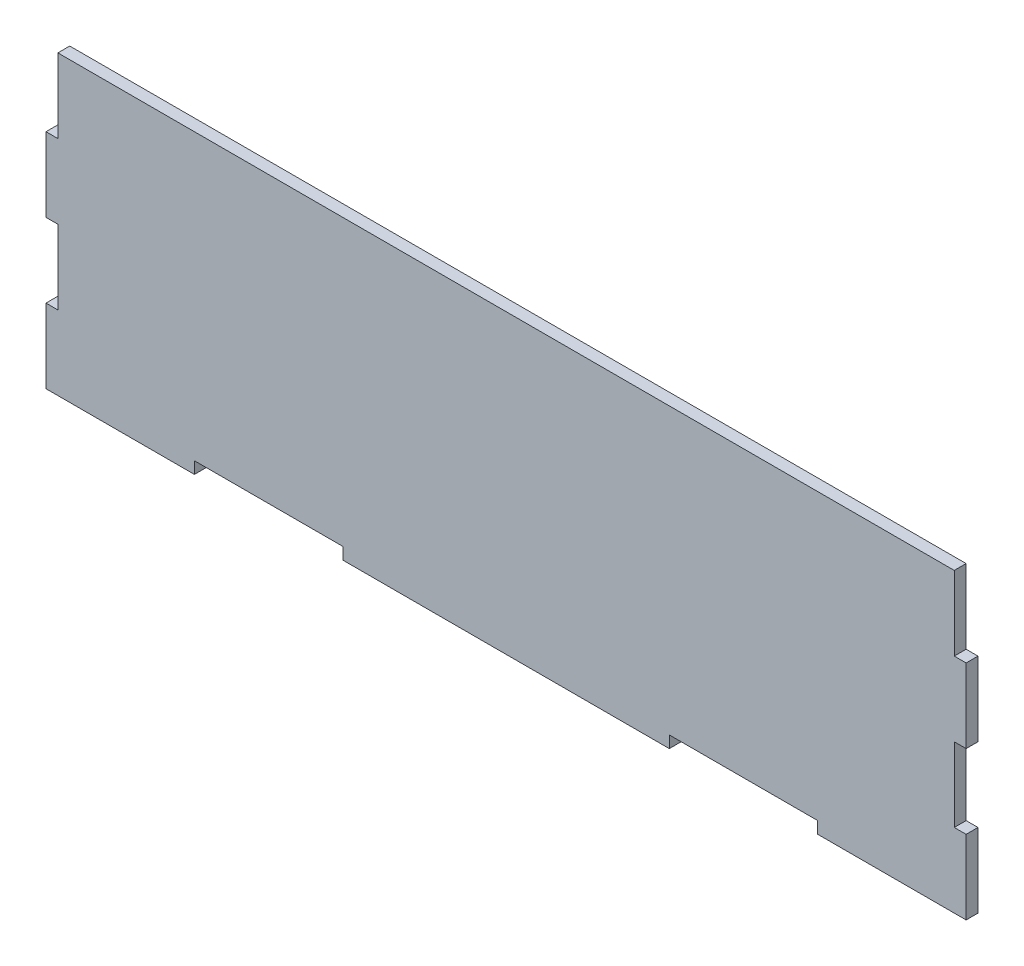
from build123d import *

# Parameters (mm, degrees)
SALIENTE_EXTRUIR1_DEPTH = 4


with BuildPart() as part:
    # Croquis1 → Saliente-Extruir1 (new body)
    with BuildSketch(Plane.XY):
        Polygon((151, 50), (-151, 50), (-151, 25), (-155, 25), (-155, 0), (-151, 0), (-151, -25), (-155, -25), (-155, -50), (-105, -50), (-105, -46), (-55, -46), (-55, -50), (55, -50), (55, -46), (105, -46), (105, -50), (155, -50), (155, -25), (151, -25), (151, 0), (155, 0), (155, 25), (151, 25), align=None)
    extrude(amount=SALIENTE_EXTRUIR1_DEPTH)


solid = part.part
